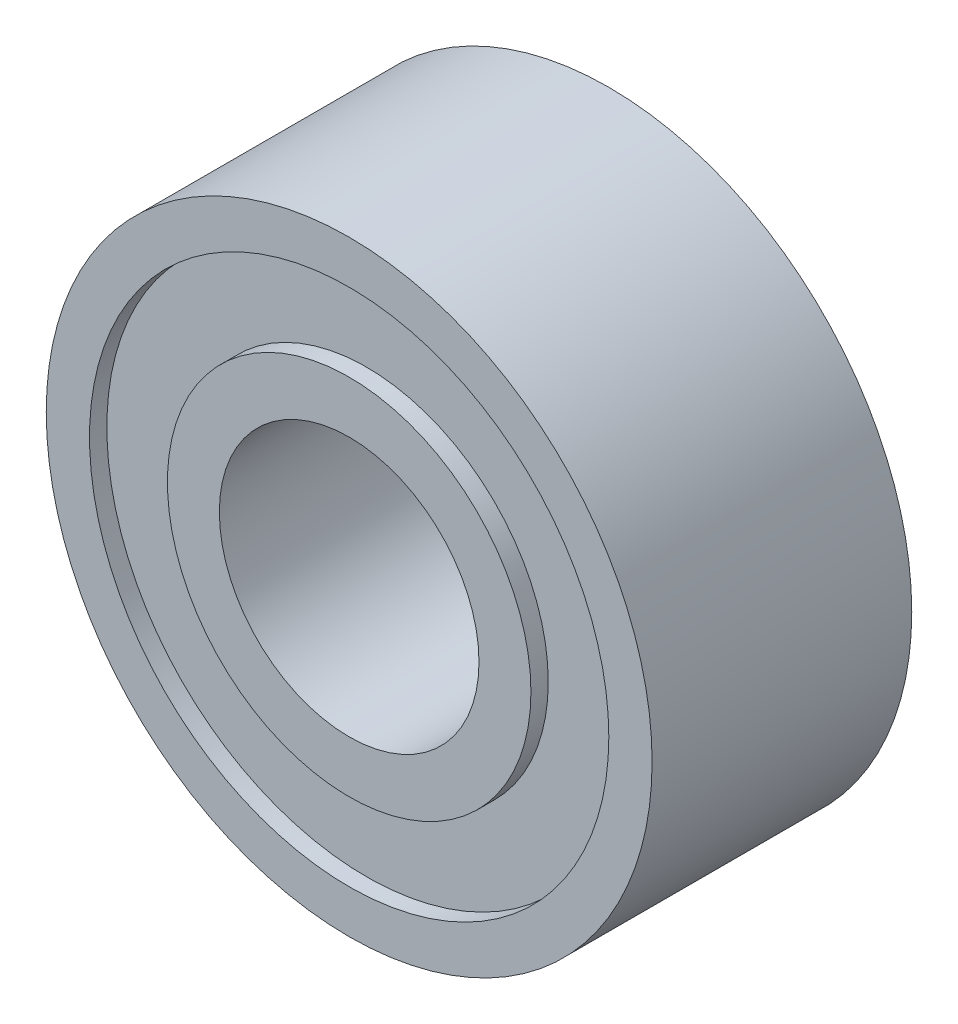
from build123d import *

# Parameters (mm, degrees)
SKETCH3_R           = 17.5
SKETCH3_R_2         = 7.5
BOSS_EXTRUDE1_DEPTH = 15
SKETCH4_R           = 15
SKETCH4_R_2         = 10.5
CUT_EXTRUDE1_DEPTH  = 1
CUT_EXTRUDE2_START  = -1
SKETCH5_R           = 15
SKETCH5_R_2         = 10.5
CUT_EXTRUDE2_DEPTH  = 1


with BuildPart() as part:
    # Sketch3 → Boss-Extrude1 (new body)
    with BuildSketch(Plane.XY):
        Circle(SKETCH3_R)
        Circle(SKETCH3_R_2, mode=Mode.SUBTRACT)
    extrude(amount=BOSS_EXTRUDE1_DEPTH)

    # Sketch4 → Cut-Extrude1 (cut)
    with BuildSketch(Plane.XY.offset(15)):
        Circle(SKETCH4_R)
        Circle(SKETCH4_R_2, mode=Mode.SUBTRACT)
    extrude(amount=-CUT_EXTRUDE1_DEPTH, mode=Mode.SUBTRACT)

    # Sketch5 → Cut-Extrude2 (cut)
    with BuildSketch(Plane(origin=(0, 0, 0), x_dir=(-1, 0, 0), z_dir=(0, 0, -1)).offset(CUT_EXTRUDE2_START)):
        with Locations(Location((0, 0, 0), (0, 0, 180))):
            Circle(SKETCH5_R)
        with Locations(Location((0, 0, 0), (0, 0, 180))):
            Circle(SKETCH5_R_2, mode=Mode.SUBTRACT)
    extrude(amount=CUT_EXTRUDE2_DEPTH, mode=Mode.SUBTRACT)


solid = part.part
